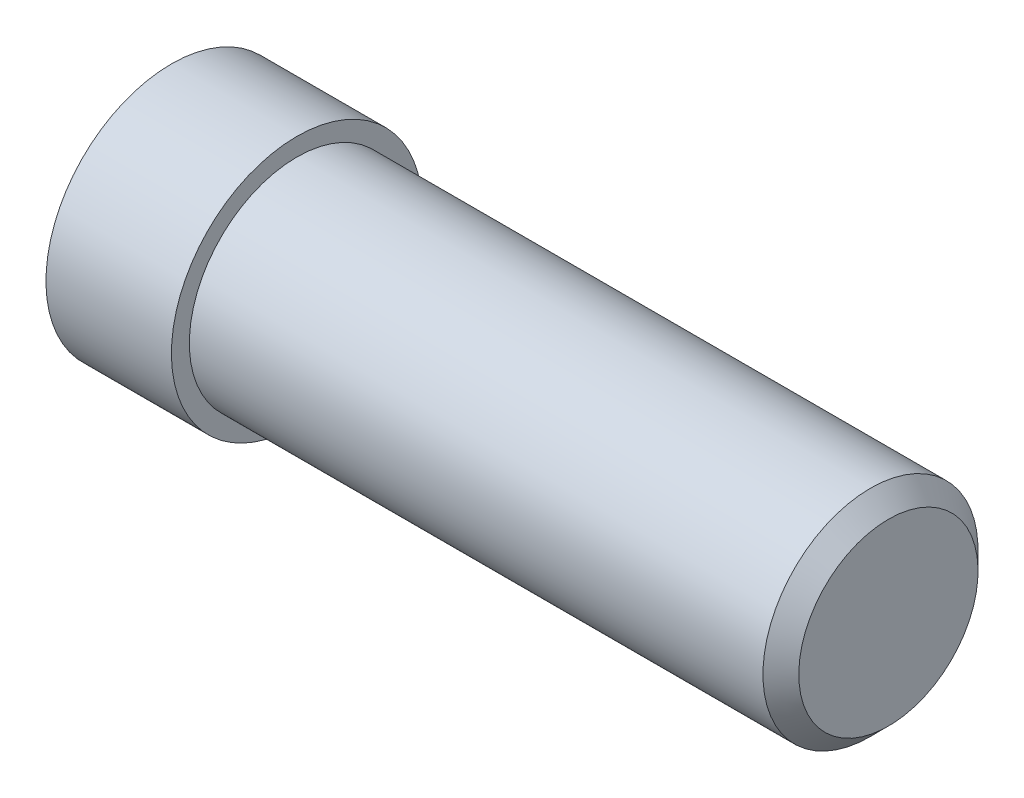
from build123d import *

# Parameters (mm, degrees)
CHAMFER1_SIZE = 1


with BuildPart() as part:
    # Sketch1 → Revolve1 (revolve)
    with BuildSketch(Plane.XY):
        Polygon((0, 0), (-40, 0), (-40, 7), (-33, 7), (-33, 6), (0, 6), align=None)
    revolve(axis=Axis((0, 0, 0), (-1, 0, 0)))

    # Chamfer1
    chamfer1_edges = [part.edges().sort_by_distance(p)[0] for p in [
        (0, -6, 0),
    ]]
    chamfer(chamfer1_edges, length=CHAMFER1_SIZE)


solid = part.part
